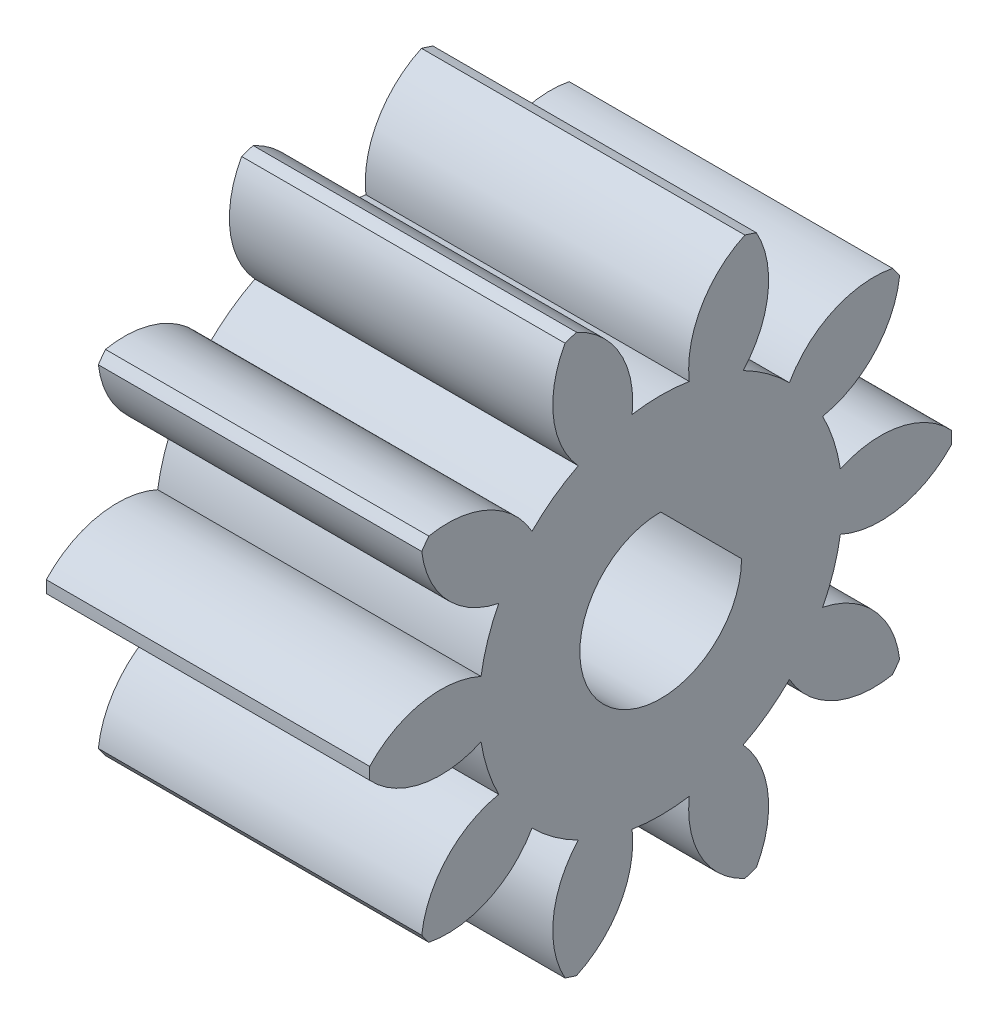
from build123d import *

# Parameters (mm, degrees)
BASPROSKE_W         = 10
BASPROSKE_H         = 9
TOOTHCUT_DEPTH      = 17.186414056
TEETHCUTS_COUNT     = 10
TEETHCUTS_ANGLE     = 324
BORSKE_R            = 2.5
BORE_DEPTH          = 50.0000508
BOSS_EXTRUDE1_DEPTH = 10


with BuildPart() as part:
    # BasProSke → Base-Revolve (revolve)
    with BuildSketch(Plane(origin=(0, 0, 0), x_dir=(1, 0, 0), z_dir=(0, 1, 0)), mode=Mode.PRIVATE) as base_revolve_sk:
        with Locations((5, 4.5)):
            Rectangle(BASPROSKE_W, BASPROSKE_H)
    revolve(base_revolve_sk.sketch.rotate(Axis((-10, 0, 0), (1, 0, 0)), 180), axis=Axis((-10, 0, 0), (1, 0, 0)))

    # TooCutSke → ToothCut (cut, through all)
    with BuildSketch(Plane(origin=(0, 0, 0), x_dir=(0, 0, -1), z_dir=(1, 0, 0))):
        with BuildLine():
            ThreePointArc((0.883878355, 5.554109745), (0, 5.624), (-0.883878355, 5.554109745))
            ThreePointArc((-0.883878355, 5.554109745), (-1.258245767, 7.379188248), (-2.637816971, 8.631324741))
            ThreePointArc((-2.637816971, 8.631324741), (0, 9.0254), (2.637816971, 8.631324741))
            ThreePointArc((2.637816971, 8.631324741), (1.258245767, 7.379188248), (0.883878355, 5.554109745))
        make_face()
    toothcut = extrude(amount=TOOTHCUT_DEPTH, mode=Mode.SUBTRACT)

    # TeethCuts: ToothCut ×10 about axis
    teethcuts_axis = Axis((-10, 0, 0), (1, 0, 0))
    for i in range(1, TEETHCUTS_COUNT):
        add(toothcut.rotate(teethcuts_axis, i * TEETHCUTS_ANGLE / (TEETHCUTS_COUNT - 1)), mode=Mode.SUBTRACT)

    # BorSke → Bore (cut, symmetric)
    with BuildSketch(Plane(origin=(0, 0, 0), x_dir=(0, 0, -1), z_dir=(1, 0, 0))):
        with Locations(Location((0, 0, 0), (0, 0, 180))):
            Circle(BORSKE_R)
    extrude(amount=BORE_DEPTH, both=True, mode=Mode.SUBTRACT)

    # Sketch1 → Boss-Extrude1 (add, through all)
    with BuildSketch(Plane(origin=(10, 0, 0), x_dir=(0, 0, -1), z_dir=(1, 0, 0))):
        with BuildLine():
            Line((0, 2.5), (2.5, 0))
            ThreePointArc((2.5, 0), (1.767766953, 1.767766953), (0, 2.5))
        make_face()
    extrude(amount=-BOSS_EXTRUDE1_DEPTH)


solid = part.part
